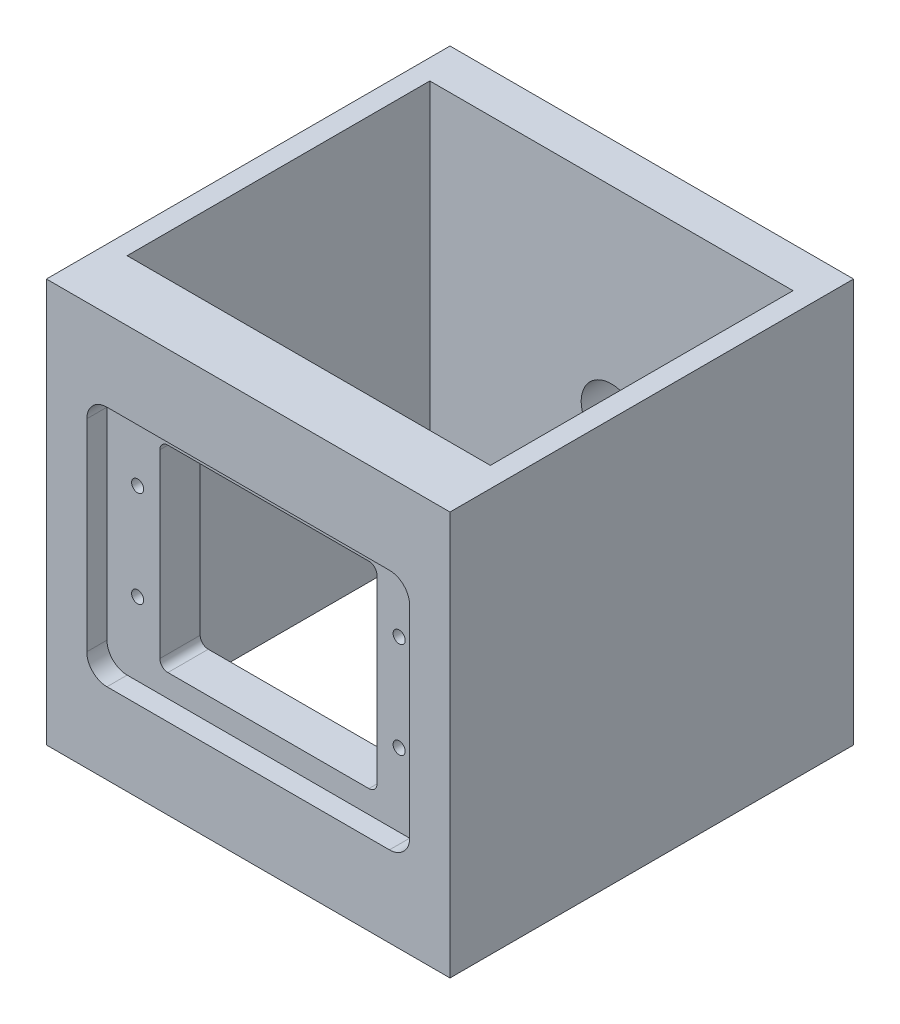
from build123d import *

# Parameters (mm, degrees)
SKETCH_1_W          = 100
SKETCH_1_H          = 100
EXTRUDE_1_DEPTH     = 100
SKETCH_2_W          = 90
SKETCH_2_H          = 75
CUT_EXTRUDE_1_DEPTH = 151
CUT_EXTRUDE_2_REACH = 124.474
SKETCH_3_R          = 7.5
CUT_EXTRUDE_3_REACH = 112.567
SKETCH_4_R          = 1.5
CUT_EXTRUDE_4_DEPTH = 5
SKETCH_6_R          = 1.5
CUT_EXTRUDE_5_DEPTH = 5


with BuildPart() as part:
    # 草圖1 → 填料-伸長1 (new body)
    with BuildSketch(Plane.XY):
        Rectangle(SKETCH_1_W, SKETCH_1_H)
    extrude(amount=EXTRUDE_1_DEPTH)

    # 草圖2 → 除料-伸長1 (cut, through all)
    with BuildSketch(Plane.XZ.offset(50)):
        with Locations((0, 47.5)):
            Rectangle(SKETCH_2_W, SKETCH_2_H)
    extrude(amount=-CUT_EXTRUDE_1_DEPTH, mode=Mode.SUBTRACT)

    # 草圖3 → 除料-伸長2 (cut, up to next)
    with BuildSketch(Plane(origin=(0, 0, 0), x_dir=(-1, 0, 0), z_dir=(0, 0, -1)), mode=Mode.PRIVATE) as cut_extrude_2_sk1:
        Circle(SKETCH_3_R)
    cut_extrude_2_tool1 = extrude(cut_extrude_2_sk1.sketch, amount=-CUT_EXTRUDE_2_REACH, mode=Mode.PRIVATE) & part.part
    add(cut_extrude_2_tool1.solids().sort_by_distance((0, 0, 0))[0], mode=Mode.SUBTRACT)

    # 草圖4 → 除料-伸長3 (cut, up to next)
    with BuildSketch(Plane(origin=(0, 0, 85), x_dir=(-1, 0, 0), z_dir=(0, 0, -1)), mode=Mode.PRIVATE) as cut_extrude_3_sk1:
        with Locations((-32.4, 11.9)):
            Circle(SKETCH_4_R)
    cut_extrude_3_tool1 = extrude(cut_extrude_3_sk1.sketch, amount=-CUT_EXTRUDE_3_REACH, mode=Mode.PRIVATE) & part.part
    # 草圖4 → 除料-伸長3 (cut, up to next)
    with BuildSketch(Plane(origin=(0, 0, 85), x_dir=(-1, 0, 0), z_dir=(0, 0, -1)), mode=Mode.PRIVATE) as cut_extrude_3_sk2:
        with Locations(Location((32.4, 11.9, 0), (0, 0, 180))):
            Circle(SKETCH_4_R)
    cut_extrude_3_tool2 = extrude(cut_extrude_3_sk2.sketch, amount=-CUT_EXTRUDE_3_REACH, mode=Mode.PRIVATE) & part.part
    # 草圖4 → 除料-伸長3 (cut, up to next)
    with BuildSketch(Plane(origin=(0, 0, 85), x_dir=(-1, 0, 0), z_dir=(0, 0, -1)), mode=Mode.PRIVATE) as cut_extrude_3_sk3:
        with Locations((32.4, -11.9)):
            Circle(SKETCH_4_R)
    cut_extrude_3_tool3 = extrude(cut_extrude_3_sk3.sketch, amount=-CUT_EXTRUDE_3_REACH, mode=Mode.PRIVATE) & part.part
    # 草圖4 → 除料-伸長3 (cut, up to next)
    with BuildSketch(Plane(origin=(0, 0, 85), x_dir=(-1, 0, 0), z_dir=(0, 0, -1)), mode=Mode.PRIVATE) as cut_extrude_3_sk4:
        with Locations(Location((-32.4, -11.9, 0), (0, 0, 180))):
            Circle(SKETCH_4_R)
    cut_extrude_3_tool4 = extrude(cut_extrude_3_sk4.sketch, amount=-CUT_EXTRUDE_3_REACH, mode=Mode.PRIVATE) & part.part
    # 草圖4 → 除料-伸長3 (cut, up to next)
    with BuildSketch(Plane(origin=(0, 0, 85), x_dir=(-1, 0, 0), z_dir=(0, 0, -1)), mode=Mode.PRIVATE) as cut_extrude_3_sk5:
        with BuildLine():
            Line((24.9, 24.4), (-24.9, 24.4))
            ThreePointArc((-24.9, 24.4), (-26.314213562, 23.814213562), (-26.9, 22.4))
            Line((-26.9, 22.4), (-26.9, -22.4))
            ThreePointArc((-26.9, -22.4), (-26.314213562, -23.814213562), (-24.9, -24.4))
            Line((-24.9, -24.4), (24.9, -24.4))
            ThreePointArc((24.9, -24.4), (26.314213562, -23.814213562), (26.9, -22.4))
            Line((26.9, -22.4), (26.9, 22.4))
            ThreePointArc((26.9, 22.4), (26.314213562, 23.814213562), (24.9, 24.4))
        make_face()
    cut_extrude_3_tool5 = extrude(cut_extrude_3_sk5.sketch, amount=-CUT_EXTRUDE_3_REACH, mode=Mode.PRIVATE) & part.part
    add(cut_extrude_3_tool1.solids().sort_by_distance((32.4, 11.9, 85))[0], mode=Mode.SUBTRACT)
    add(cut_extrude_3_tool2.solids().sort_by_distance((-32.4, 11.9, 85))[0], mode=Mode.SUBTRACT)
    add(cut_extrude_3_tool3.solids().sort_by_distance((-32.4, -11.9, 85))[0], mode=Mode.SUBTRACT)
    add(cut_extrude_3_tool4.solids().sort_by_distance((32.4, -11.9, 85))[0], mode=Mode.SUBTRACT)
    add(cut_extrude_3_tool5.solids().sort_by_distance((0, 0, 85))[0], mode=Mode.SUBTRACT)

    # 草圖5 → 除料-伸長4 (cut)
    with BuildSketch(Plane.XY.offset(100)):
        with BuildLine():
            Line((-35, 30), (35, 30))
            ThreePointArc((35, 30), (38.535533906, 28.535533906), (40, 25))
            Line((40, 25), (40, -25))
            ThreePointArc((40, -25), (38.535533906, -28.535533906), (35, -30))
            Line((35, -30), (-35, -30))
            ThreePointArc((-35, -30), (-38.535533906, -28.535533906), (-40, -25))
            Line((-40, -25), (-40, 25))
            ThreePointArc((-40, 25), (-38.535533906, 28.535533906), (-35, 30))
        make_face()
    extrude(amount=-CUT_EXTRUDE_4_DEPTH, mode=Mode.SUBTRACT)

    # 草圖6 → 除料-伸長5 (cut)
    # profile 1 of 18: a face of its own
    with BuildSketch(Plane(origin=(0, 0, 85), x_dir=(-1, 0, 0), z_dir=(0, 0, -1))):
        with BuildLine():
            ThreePointArc((-29.239866432, 21), (-32.239866432, 24), (-35.239866432, 21))
            Line((-35.239866432, 21), (-29.239866432, 21))
        make_face()
    # profile 2 of 18: a face of its own
    with BuildSketch(Plane(origin=(0, 0, 85), x_dir=(-1, 0, 0), z_dir=(0, 0, -1))):
        with BuildLine():
            Line((-29.239866432, 21), (-35.239866432, 21))
            ThreePointArc((-35.239866432, 21), (-32.239866432, 18), (-29.239866432, 21))
        make_face()
    # profile 3 of 18: a face of its own
    with BuildSketch(Plane(origin=(0, 0, 85), x_dir=(-1, 0, 0), z_dir=(0, 0, -1))):
        with BuildLine():
            ThreePointArc((-29.239866432, 21), (-32.239866432, 24), (-35.239866432, 21))
            Line((-35.239866432, 21), (-29.239866432, 21))
        make_face()
    # profile 4 of 18: a face of its own
    with BuildSketch(Plane(origin=(0, 0, 85), x_dir=(-1, 0, 0), z_dir=(0, 0, -1))):
        with BuildLine():
            Line((-29.239866432, 21), (-35.239866432, 21))
            ThreePointArc((-35.239866432, 21), (-32.239866432, 18), (-29.239866432, 21))
        make_face()
    # profile 5 of 18: a face of its own
    with BuildSketch(Plane(origin=(0, 0, 85), x_dir=(-1, 0, 0), z_dir=(0, 0, -1))):
        with BuildLine():
            ThreePointArc((-29.239866432, 21), (-32.239866432, 18), (-35.239866432, 21))
            Line((-35.239866432, 21), (-35.239866432, -21))
            ThreePointArc((-35.239866432, -21), (-32.239866432, -18), (-29.239866432, -21))
            Line((-29.239866432, -21), (-29.239866432, 21))
        make_face()
        with Locations((-32.4, -11.9)):
            Circle(SKETCH_6_R, mode=Mode.SUBTRACT)
        with Locations((-32.4, 11.9)):
            Circle(SKETCH_6_R, mode=Mode.SUBTRACT)
    # profile 6 of 18: a face of its own
    with BuildSketch(Plane(origin=(0, 0, 85), x_dir=(-1, 0, 0), z_dir=(0, 0, -1))):
        with BuildLine():
            ThreePointArc((-29.239866432, -21), (-32.239866432, -18), (-35.239866432, -21))
            Line((-35.239866432, -21), (-29.239866432, -21))
        make_face()
    # profile 7 of 18: a face of its own
    with BuildSketch(Plane(origin=(0, 0, 85), x_dir=(-1, 0, 0), z_dir=(0, 0, -1))):
        with BuildLine():
            Line((-29.239866432, -21), (-35.239866432, -21))
            ThreePointArc((-35.239866432, -21), (-32.239866432, -24), (-29.239866432, -21))
        make_face()
    # profile 8 of 18: a face of its own
    with BuildSketch(Plane(origin=(0, 0, 85), x_dir=(-1, 0, 0), z_dir=(0, 0, -1))):
        with BuildLine():
            ThreePointArc((-29.239866432, -21), (-32.239866432, -18), (-35.239866432, -21))
            Line((-35.239866432, -21), (-29.239866432, -21))
        make_face()
    # profile 9 of 18: a face of its own
    with BuildSketch(Plane(origin=(0, 0, 85), x_dir=(-1, 0, 0), z_dir=(0, 0, -1))):
        with BuildLine():
            Line((-29.239866432, -21), (-35.239866432, -21))
            ThreePointArc((-35.239866432, -21), (-32.239866432, -24), (-29.239866432, -21))
        make_face()
    # profile 10 of 18: a face of its own
    with BuildSketch(Plane(origin=(0, 0, 85), x_dir=(-1, 0, 0), z_dir=(0, 0, -1))):
        with BuildLine():
            ThreePointArc((29.239866432, 21), (32.239866432, 18), (35.239866432, 21))
            Line((35.239866432, 21), (29.239866432, 21))
        make_face()
    # profile 11 of 18: a face of its own
    with BuildSketch(Plane(origin=(0, 0, 85), x_dir=(-1, 0, 0), z_dir=(0, 0, -1))):
        with BuildLine():
            Line((29.239866432, 21), (35.239866432, 21))
            ThreePointArc((35.239866432, 21), (32.239866432, 24), (29.239866432, 21))
        make_face()
    # profile 12 of 18: a face of its own
    with BuildSketch(Plane(origin=(0, 0, 85), x_dir=(-1, 0, 0), z_dir=(0, 0, -1))):
        with BuildLine():
            ThreePointArc((29.239866432, 21), (32.239866432, 18), (35.239866432, 21))
            Line((35.239866432, 21), (29.239866432, 21))
        make_face()
    # profile 13 of 18: a face of its own
    with BuildSketch(Plane(origin=(0, 0, 85), x_dir=(-1, 0, 0), z_dir=(0, 0, -1))):
        with BuildLine():
            Line((29.239866432, 21), (35.239866432, 21))
            ThreePointArc((35.239866432, 21), (32.239866432, 24), (29.239866432, 21))
        make_face()
    # profile 14 of 18: a face of its own
    with BuildSketch(Plane(origin=(0, 0, 85), x_dir=(-1, 0, 0), z_dir=(0, 0, -1))):
        with BuildLine():
            ThreePointArc((29.239866432, -21), (32.239866432, -18), (35.239866432, -21))
            Line((35.239866432, -21), (35.239866432, 21))
            ThreePointArc((35.239866432, 21), (32.239866432, 18), (29.239866432, 21))
            Line((29.239866432, 21), (29.239866432, -21))
        make_face()
        with Locations((32.4, -11.9)):
            Circle(SKETCH_6_R, mode=Mode.SUBTRACT)
        with Locations((32.4, 11.9)):
            Circle(SKETCH_6_R, mode=Mode.SUBTRACT)
    # profile 15 of 18: a face of its own
    with BuildSketch(Plane(origin=(0, 0, 85), x_dir=(-1, 0, 0), z_dir=(0, 0, -1))):
        with BuildLine():
            ThreePointArc((29.239866432, -21), (32.239866432, -24), (35.239866432, -21))
            Line((35.239866432, -21), (29.239866432, -21))
        make_face()
    # profile 16 of 18: a face of its own
    with BuildSketch(Plane(origin=(0, 0, 85), x_dir=(-1, 0, 0), z_dir=(0, 0, -1))):
        with BuildLine():
            Line((29.239866432, -21), (35.239866432, -21))
            ThreePointArc((35.239866432, -21), (32.239866432, -18), (29.239866432, -21))
        make_face()
    # profile 17 of 18: a face of its own
    with BuildSketch(Plane(origin=(0, 0, 85), x_dir=(-1, 0, 0), z_dir=(0, 0, -1))):
        with BuildLine():
            ThreePointArc((29.239866432, -21), (32.239866432, -24), (35.239866432, -21))
            Line((35.239866432, -21), (29.239866432, -21))
        make_face()
    # profile 18 of 18: a face of its own
    with BuildSketch(Plane(origin=(0, 0, 85), x_dir=(-1, 0, 0), z_dir=(0, 0, -1))):
        with BuildLine():
            Line((29.239866432, -21), (35.239866432, -21))
            ThreePointArc((35.239866432, -21), (32.239866432, -18), (29.239866432, -21))
        make_face()
    extrude(amount=-CUT_EXTRUDE_5_DEPTH, mode=Mode.SUBTRACT)


solid = part.part
